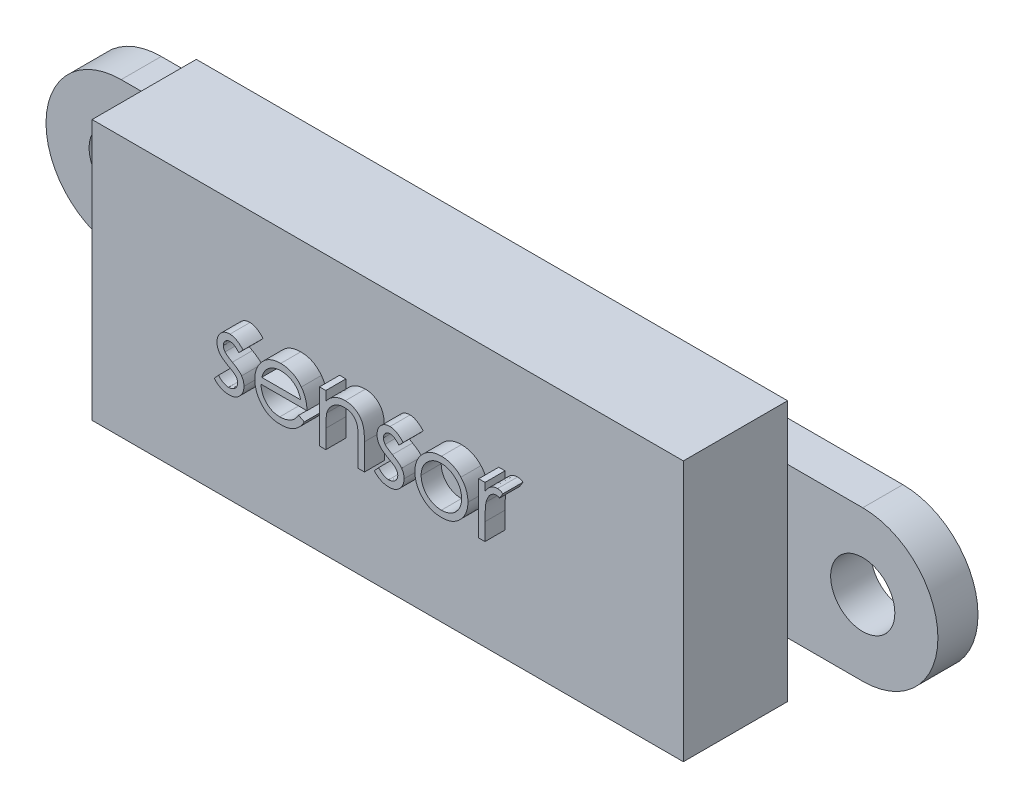
from build123d import *

# Parameters (mm, degrees)
SKETCH_1_R      = 1.6
EXTRUDE_1_DEPTH = 2
SKETCH_2_W      = 29.5
SKETCH_2_H      = 13
EXTRUDE_2_DEPTH = 5.2
EXTRUDE_3_DEPTH = 1


with BuildPart() as part:
    # ｽｹｯﾁ1 → ﾎﾞｽ - 押し出し1 (new body)
    with BuildSketch(Plane.XY):
        with BuildLine():
            Line((-18.5, 3.75), (18.5, 3.75))
            ThreePointArc((18.5, 3.75), (22.25, 0), (18.5, -3.75))
            Line((18.5, -3.75), (-18.5, -3.75))
            ThreePointArc((-18.5, -3.75), (-22.25, 0), (-18.5, 3.75))
        make_face()
        with Locations((-18.5, 0)):
            Circle(SKETCH_1_R, mode=Mode.SUBTRACT)
        with Locations((18.5, 0)):
            Circle(SKETCH_1_R, mode=Mode.SUBTRACT)
    extrude(amount=EXTRUDE_1_DEPTH)

    # ｽｹｯﾁ2 → ﾎﾞｽ - 押し出し2 (add)
    with BuildSketch(Plane.XY.offset(2)):
        Rectangle(SKETCH_2_W, SKETCH_2_H)
    extrude(amount=EXTRUDE_2_DEPTH)

    # ｽｹｯﾁ3 → ﾎﾞｽ - 押し出し3 (add)
    # profile 1 of 6: a face of its own
    with BuildSketch(Plane.XY.offset(7.2)):
        with BuildLine():
            Line((-6.217257934, 1.304073049), (-6.430398959, 1.084621927))
            add(Edge.make_bspline(
                [(-6.430398959, 1.084621927), (-6.448789463, 1.105935073), (-6.484244189, 1.14702431), (-6.54047567, 1.201961377), (-6.596499273, 1.248098316), (-6.651548087, 1.287050575), (-6.707006356, 1.316499721), (-6.762223274, 1.337994583), (-6.817256013, 1.351296389), (-6.854042048, 1.353010828), (-6.87210569, 1.353852696)],
                knots=[0, 0, 0, 0, 1.26578478, 2.440284043, 3.530471711, 4.527705817, 5.468200915, 6.346673037, 7.188140097, 8, 8, 8, 8], degree=3))
            add(Edge.make_bspline(
                [(-6.87210569, 1.353852696), (-6.89424508, 1.352777823), (-6.937812266, 1.350662625), (-7.000238084, 1.329549195), (-7.058188709, 1.297140457), (-7.108345689, 1.251171873), (-7.150833369, 1.198407604), (-7.18184705, 1.139411279), (-7.200813034, 1.075963236), (-7.203217766, 1.031933378), (-7.204437421, 1.009601895)],
                knots=[0, 0, 0, 0, 0.99966794, 1.967205029, 2.953328237, 3.988086729, 5.028030931, 6.008226631, 6.989793394, 8, 8, 8, 8], degree=3))
            add(Edge.make_bspline(
                [(-7.204437421, 1.009601895), (-7.203326609, 0.989389851), (-7.201108115, 0.94902274), (-7.183861436, 0.889474706), (-7.156395364, 0.831417668), (-7.13072517, 0.795854762), (-7.117498318, 0.777530581)],
                knots=[0, 0, 0, 0, 0.960159726, 1.917612774, 2.927026955, 4, 4, 4, 4], degree=3))
            add(Edge.make_bspline(
                [(-7.117498318, 0.777530581), (-7.109534825, 0.767745996), (-7.092585532, 0.746920742), (-7.060777017, 0.718016889), (-7.024754514, 0.686074638), (-6.981434576, 0.654137801), (-6.932683548, 0.620506075), (-6.877444264, 0.586503942), (-6.817469759, 0.549539517), (-6.774532453, 0.526095082), (-6.752213863, 0.513908786)],
                knots=[0, 0, 0, 0, 0.66740084, 1.420478572, 2.27185888, 3.217733974, 4.268547843, 5.408967954, 6.65319498, 8, 8, 8, 8], degree=3))
            add(Edge.make_bspline(
                [(-6.752213863, 0.513908786), (-6.725000286, 0.498663883), (-6.672432616, 0.469215751), (-6.597739849, 0.423506047), (-6.529952808, 0.378074623), (-6.46849714, 0.333407349), (-6.414555331, 0.288254481), (-6.366490779, 0.244346724), (-6.325502335, 0.200357416), (-6.302548408, 0.169624303), (-6.291576844, 0.154934427)],
                knots=[0, 0, 0, 0, 1.27191281, 2.456916733, 3.569705269, 4.599008579, 5.553216877, 6.436649441, 7.252746552, 8, 8, 8, 8], degree=3))
            add(Edge.make_bspline(
                [(-6.291576844, 0.154934427), (-6.273366317, 0.125268339), (-6.237123987, 0.066227318), (-6.199065721, -0.03099111), (-6.177005446, -0.134101612), (-6.173943226, -0.204633832), (-6.172386139, -0.240498265)],
                knots=[0, 0, 0, 0, 0.995354457, 1.980940102, 2.973342416, 4, 4, 4, 4], degree=3))
            add(Edge.make_bspline(
                [(-6.172386139, -0.240498265), (-6.173105673, -0.265767412), (-6.174523593, -0.315563025), (-6.18438166, -0.388897854), (-6.201336636, -0.459032412), (-6.22443039, -0.526727697), (-6.255614763, -0.590686636), (-6.29216256, -0.652522885), (-6.336037472, -0.710898816), (-6.386128847, -0.765737776), (-6.440974341, -0.815823524), (-6.49948048, -0.859847478), (-6.56171931, -0.896421815), (-6.627246112, -0.92668716), (-6.696209766, -0.950755418), (-6.768621055, -0.967417949), (-6.84424981, -0.97739071), (-6.895679618, -0.978775186), (-6.921885338, -0.979480637)],
                knots=[0, 0, 0, 0, 1.032770009, 2.035186124, 3.017557409, 3.978232242, 4.952395191, 5.920591857, 6.910227898, 7.931268572, 8.952309245, 9.941945286, 10.918353717, 11.897095711, 12.887975737, 13.898235213, 14.929059601, 16, 16, 16, 16], degree=3))
            add(Edge.make_bspline(
                [(-6.921885338, -0.979480637), (-6.957252513, -0.978487937), (-7.02749544, -0.97651633), (-7.131385159, -0.958010268), (-7.232905918, -0.929214875), (-7.331289458, -0.88949894), (-7.424335572, -0.839348228), (-7.509466497, -0.779285834), (-7.586977959, -0.711295837), (-7.631096233, -0.659182926), (-7.65315537, -0.63312647)],
                knots=[0, 0, 0, 0, 1.013940152, 2.01379169, 3.017749504, 4.037548394, 5.051665909, 6.043208538, 7.021604269, 8, 8, 8, 8], degree=3))
            Line((-7.65315537, -0.63312647), (-7.444922197, -0.396147304))
            add(Edge.make_bspline(
                [(-7.444922197, -0.396147304), (-7.425149784, -0.417502068), (-7.386817971, -0.458901508), (-7.325516755, -0.514025849), (-7.263137353, -0.56022712), (-7.200302667, -0.598870535), (-7.136082573, -0.628645938), (-7.070836958, -0.649564532), (-7.004698534, -0.663008724), (-6.960276398, -0.664587006), (-6.938011139, -0.665378073)],
                knots=[0, 0, 0, 0, 1.179806542, 2.287233372, 3.337373186, 4.324005949, 5.273901747, 6.200048787, 7.097828587, 8, 8, 8, 8], degree=3))
            add(Edge.make_bspline(
                [(-6.938011139, -0.665378073), (-6.907693213, -0.664007248), (-6.848457071, -0.661328886), (-6.763613313, -0.637011794), (-6.685274686, -0.598881843), (-6.617251341, -0.544797144), (-6.55934918, -0.481841572), (-6.517421005, -0.410927452), (-6.49114483, -0.334135996), (-6.488058831, -0.280903693), (-6.486488703, -0.253819579)],
                knots=[0, 0, 0, 0, 1.072336372, 2.095165389, 3.102688358, 4.141489647, 5.156069229, 6.117746104, 7.042326257, 8, 8, 8, 8], degree=3))
            add(Edge.make_bspline(
                [(-6.486488703, -0.253819579), (-6.487574997, -0.231509961), (-6.48971974, -0.187462605), (-6.506563012, -0.123712264), (-6.533175864, -0.063242983), (-6.559380513, -0.027853336), (-6.572726684, -0.009829195)],
                knots=[0, 0, 0, 0, 1.013901739, 2.00181326, 2.98231254, 4, 4, 4, 4], degree=3))
            add(Edge.make_bspline(
                [(-6.572726684, -0.009829195), (-6.580749078, -0.000793833), (-6.598224751, 0.018888449), (-6.630279992, 0.047313528), (-6.668661854, 0.077951627), (-6.713802017, 0.110283216), (-6.765791479, 0.143881822), (-6.824840954, 0.178571174), (-6.890141507, 0.2159989), (-6.936312138, 0.240818555), (-6.960447036, 0.2537926)],
                knots=[0, 0, 0, 0, 0.615000592, 1.339693406, 2.178160186, 3.116406724, 4.166410947, 5.330106347, 6.604359322, 8, 8, 8, 8], degree=3))
            add(Edge.make_bspline(
                [(-6.960447036, 0.2537926), (-6.986493676, 0.268331732), (-7.037006424, 0.296527748), (-7.108553715, 0.340443828), (-7.173101069, 0.385111103), (-7.232201644, 0.428023942), (-7.284362649, 0.471444886), (-7.329378598, 0.515422138), (-7.369021813, 0.558182124), (-7.390969225, 0.58847942), (-7.401452645, 0.602951254)],
                knots=[0, 0, 0, 0, 1.262093308, 2.447601706, 3.550203992, 4.582594899, 5.537233252, 6.418365656, 7.244515135, 8, 8, 8, 8], degree=3))
            add(Edge.make_bspline(
                [(-7.401452645, 0.602951254), (-7.419583245, 0.632096869), (-7.45585078, 0.690398284), (-7.491065971, 0.787708761), (-7.515272, 0.890153818), (-7.51743439, 0.960840673), (-7.518539985, 0.996981703)],
                knots=[0, 0, 0, 0, 0.985009483, 1.970363186, 2.962279964, 4, 4, 4, 4], degree=3))
            add(Edge.make_bspline(
                [(-7.518539985, 0.996981703), (-7.51800579, 1.020607101), (-7.516960294, 1.066845352), (-7.508616242, 1.134784172), (-7.493424531, 1.199332326), (-7.474369608, 1.261459189), (-7.447886604, 1.319961283), (-7.416240699, 1.375618754), (-7.379053274, 1.428354672), (-7.336209983, 1.477357804), (-7.289103338, 1.52186713), (-7.238208568, 1.560665758), (-7.184670311, 1.593772113), (-7.128261892, 1.621537274), (-7.068441419, 1.642538656), (-7.005627033, 1.656996041), (-6.939945878, 1.666651244), (-6.895044752, 1.667514328), (-6.87210569, 1.66795526)],
                knots=[0, 0, 0, 0, 1.087655834, 2.128696564, 3.144119009, 4.137814668, 5.115653402, 6.093965665, 7.082169637, 8.081268856, 9.086088321, 10.061021666, 11.022561449, 11.980240094, 12.950172527, 13.934149372, 14.944599409, 16, 16, 16, 16], degree=3))
            add(Edge.make_bspline(
                [(-6.87210569, 1.66795526), (-6.844913627, 1.66685092), (-6.790019405, 1.664621522), (-6.707664779, 1.646915831), (-6.625431437, 1.617782727), (-6.543108087, 1.577546494), (-6.461297797, 1.525479618), (-6.379280941, 1.462550319), (-6.29607291, 1.389172604), (-6.244116597, 1.333073379), (-6.217257934, 1.304073049)],
                knots=[0, 0, 0, 0, 0.845714091, 1.707292901, 2.609013841, 3.555613372, 4.552488639, 5.621697636, 6.770543573, 8, 8, 8, 8], degree=3))
        make_face()
    # profile 2 of 6: a face of its own
    with BuildSketch(Plane.XY.offset(7.2)):
        with BuildLine():
            Line((-3.445022357, -0.126916535), (-3.165975882, -0.27345099))
            add(Edge.make_bspline(
                [(-3.165975882, -0.27345099), (-3.188212478, -0.312894321), (-3.231476086, -0.389635424), (-3.305876834, -0.495067284), (-3.383868907, -0.589915), (-3.468972875, -0.671644654), (-3.558642554, -0.742896039), (-3.653375208, -0.805233864), (-3.753664026, -0.858352384), (-3.859513751, -0.903104912), (-3.971813302, -0.937514406), (-4.090834818, -0.961818627), (-4.216806314, -0.976841896), (-4.303152494, -0.978587037), (-4.347366107, -0.979480637)],
                knots=[0, 0, 0, 0, 1.120438281, 2.179929193, 3.190490725, 4.156257408, 5.095198341, 6.022838206, 6.959905092, 7.901321166, 8.864066838, 9.862729781, 10.905609505, 12, 12, 12, 12], degree=3))
            add(Edge.make_bspline(
                [(-4.347366107, -0.979480637), (-4.396508084, -0.978333462), (-4.492369846, -0.976095655), (-4.631909593, -0.956803191), (-4.763289012, -0.925330832), (-4.886500715, -0.88136529), (-5.001242967, -0.823937966), (-5.107743822, -0.753978485), (-5.206563348, -0.67184623), (-5.294587557, -0.576829786), (-5.37383144, -0.475147829), (-5.44375726, -0.369191945), (-5.502214691, -0.25922872), (-5.549767301, -0.145958196), (-5.588172166, -0.030094303), (-5.61493887, 0.089417165), (-5.630368618, 0.212252749), (-5.632733063, 0.295350085), (-5.6339246, 0.337226094)],
                knots=[0, 0, 0, 0, 1.145258523, 2.234067595, 3.276747158, 4.290159414, 5.277019952, 6.260822364, 7.254936242, 8.264827045, 9.274100331, 10.257902744, 11.220704747, 12.172965371, 13.118907548, 14.062713208, 15.023725156, 16, 16, 16, 16], degree=3))
            add(Edge.make_bspline(
                [(-5.6339246, 0.337226094), (-5.632865459, 0.376520924), (-5.630766381, 0.454398089), (-5.617535593, 0.569663633), (-5.5940873, 0.681692086), (-5.561910976, 0.790576534), (-5.52035973, 0.896134668), (-5.469527511, 0.998430731), (-5.409335133, 1.097355871), (-5.362862459, 1.159759005), (-5.339453447, 1.19119244)],
                knots=[0, 0, 0, 0, 1.024358464, 2.0301432, 3.019427413, 4.004406732, 4.986367066, 5.972626655, 6.978780325, 8, 8, 8, 8], degree=3))
            add(Edge.make_bspline(
                [(-5.339453447, 1.19119244), (-5.307745764, 1.22906131), (-5.245334817, 1.30359946), (-5.139778462, 1.401537786), (-5.025478265, 1.483581561), (-4.903866639, 1.551588697), (-4.773530165, 1.603262344), (-4.636220874, 1.641769927), (-4.490375288, 1.663347938), (-4.390670067, 1.666395771), (-4.339653767, 1.66795526)],
                knots=[0, 0, 0, 0, 1.030682036, 2.02871468, 2.997146059, 3.962720338, 4.930598197, 5.918074684, 6.934738563, 8, 8, 8, 8], degree=3))
            add(Edge.make_bspline(
                [(-4.339653767, 1.66795526), (-4.287206162, 1.666601211), (-4.184315916, 1.663944876), (-4.034283795, 1.639318543), (-3.892323078, 1.600265988), (-3.758490574, 1.545112198), (-3.632772713, 1.473952646), (-3.515986664, 1.385810804), (-3.406135151, 1.283392717), (-3.342226572, 1.204629508), (-3.30970585, 1.164549812)],
                knots=[0, 0, 0, 0, 1.056321875, 2.072262726, 3.055038591, 4.01806755, 4.982017516, 5.957941055, 6.960871419, 8, 8, 8, 8], degree=3))
            add(Edge.make_bspline(
                [(-3.30970585, 1.164549812), (-3.287578912, 1.13434623), (-3.243472319, 1.074140111), (-3.188225219, 0.975968954), (-3.140267824, 0.87325836), (-3.101934863, 0.764348063), (-3.070895362, 0.650528483), (-3.048438543, 0.530985938), (-3.035268924, 0.405756027), (-3.032680227, 0.320429471), (-3.031360498, 0.276929619)],
                knots=[0, 0, 0, 0, 0.94817472, 1.890038105, 2.849395472, 3.817997239, 4.812318967, 5.836947057, 6.897266129, 8, 8, 8, 8], degree=3))
            Line((-3.031360498, 0.276929619), (-5.319822036, 0.276929619))
            add(Edge.make_bspline(
                [(-5.319822036, 0.276929619), (-5.31828243, 0.243229155), (-5.315254856, 0.176958551), (-5.301139713, 0.079987768), (-5.278890939, -0.012385574), (-5.247621876, -0.099468616), (-5.209755031, -0.182398743), (-5.163369314, -0.26056078), (-5.10802976, -0.33359871), (-5.046304061, -0.402165848), (-4.977596966, -0.463226609), (-4.905314218, -0.517878385), (-4.828420653, -0.563683982), (-4.74752257, -0.600863872), (-4.662750785, -0.629970188), (-4.57407859, -0.649838009), (-4.481680473, -0.663145116), (-4.418694739, -0.664624781), (-4.386628927, -0.665378073)],
                knots=[0, 0, 0, 0, 1.094153842, 2.151609401, 3.174256925, 4.172055639, 5.149267565, 6.128595816, 7.11444997, 8.118368179, 9.117203808, 10.09244225, 11.054858984, 12.015122123, 12.976791628, 13.957293641, 14.960065497, 16, 16, 16, 16], degree=3))
            add(Edge.make_bspline(
                [(-4.386628927, -0.665378073), (-4.35527778, -0.664770016), (-4.293071089, -0.663563515), (-4.200430231, -0.651831604), (-4.109290704, -0.632861329), (-4.020029721, -0.606971339), (-3.934458875, -0.575394487), (-3.855213325, -0.537291629), (-3.782333109, -0.495141882), (-3.714216143, -0.446932207), (-3.648145149, -0.38792402), (-3.582602663, -0.314288299), (-3.512326009, -0.227200771), (-3.468336417, -0.161655105), (-3.445022357, -0.126916535)],
                knots=[0, 0, 0, 0, 0.99110716, 1.966546729, 2.947904876, 3.932708344, 4.903319531, 5.828989031, 6.710028674, 7.56322171, 8.463672341, 9.504779593, 10.677557249, 12, 12, 12, 12], degree=3))
        make_face()
        with BuildLine():
            add(Edge.make_bspline(
                [(-3.345463062, 0.591032183), (-3.356959686, 0.632695057), (-3.379086988, 0.712882678), (-3.425323352, 0.823923568), (-3.477394893, 0.922611469), (-3.539016624, 1.008191102), (-3.60883535, 1.084194615), (-3.689480533, 1.1506132), (-3.779916426, 1.210030651), (-3.879675567, 1.260183151), (-3.985317352, 1.30287301), (-4.095923544, 1.331498125), (-4.208781332, 1.351107668), (-4.285115618, 1.352933776), (-4.323527966, 1.353852696)],
                knots=[0, 0, 0, 0, 1.154881502, 2.222775134, 3.210006277, 4.132804581, 5.035138423, 5.962687519, 6.919655026, 7.923214229, 8.944639381, 9.960483929, 10.97369054, 12, 12, 12, 12], degree=3))
            add(Edge.make_bspline(
                [(-4.323527966, 1.353852696), (-4.354877404, 1.353241025), (-4.416848653, 1.352031879), (-4.508149722, 1.340561749), (-4.59582942, 1.321601904), (-4.680534708, 1.295636948), (-4.761155576, 1.261028345), (-4.839350345, 1.220445119), (-4.913130741, 1.170903535), (-4.959272036, 1.13314468), (-4.982582453, 1.114069042)],
                knots=[0, 0, 0, 0, 1.04873581, 2.073130211, 3.073294108, 4.04793562, 5.032784715, 6.005352987, 6.992311501, 8, 8, 8, 8], degree=3))
            add(Edge.make_bspline(
                [(-4.982582453, 1.114069042), (-4.999275735, 1.098974727), (-5.033058869, 1.068427511), (-5.078199391, 1.015798304), (-5.121419863, 0.959046742), (-5.160753516, 0.896001617), (-5.196831103, 0.827380838), (-5.23059108, 0.753763203), (-5.260977492, 0.674590073), (-5.278073602, 0.619417634), (-5.286869312, 0.591032183)],
                knots=[0, 0, 0, 0, 0.879870761, 1.780643979, 2.707998968, 3.669668524, 4.684282772, 5.740141944, 6.837334558, 8, 8, 8, 8], degree=3))
            Line((-5.286869312, 0.591032183), (-3.345463062, 0.591032183))
        make_face(mode=Mode.SUBTRACT)
    # profile 3 of 6: a face of its own
    with BuildSketch(Plane.XY.offset(7.2)):
        with BuildLine():
            Line((-2.40315537, 1.623083465), (-2.089052806, 1.623083465))
            Line((-2.089052806, 1.623083465), (-2.089052806, 1.161745324))
            add(Edge.make_bspline(
                [(-2.089052806, 1.161745324), (-2.05551517, 1.203588047), (-1.990434219, 1.284785311), (-1.882049886, 1.391505885), (-1.767505986, 1.47945111), (-1.647503982, 1.549554904), (-1.521880972, 1.60240153), (-1.391402702, 1.640567462), (-1.255287996, 1.66345229), (-1.162723559, 1.66644252), (-1.115895754, 1.66795526)],
                knots=[0, 0, 0, 0, 1.12780773, 2.188550248, 3.19190651, 4.159438251, 5.104880172, 6.052711206, 7.014878035, 8, 8, 8, 8], degree=3))
            add(Edge.make_bspline(
                [(-1.115895754, 1.66795526), (-1.06856512, 1.666210065), (-0.975927652, 1.662794296), (-0.841049591, 1.635777605), (-0.715076197, 1.58963235), (-0.598456642, 1.52642028), (-0.493329428, 1.447813806), (-0.401004577, 1.356236025), (-0.324641329, 1.250899941), (-0.273443966, 1.153176785), (-0.239718319, 1.066487991), (-0.218485981, 0.992241241), (-0.200455, 0.90952309), (-0.184823252, 0.818583501), (-0.17424614, 0.71878531), (-0.165903848, 0.610537618), (-0.159925154, 0.493875488), (-0.159687947, 0.41318886), (-0.159565626, 0.371581062)],
                knots=[0, 0, 0, 0, 1.235846778, 2.418850247, 3.575807741, 4.728682307, 5.871620074, 6.994088408, 8.11269785, 9.256955736, 9.865816715, 10.540099792, 11.271859618, 12.076849838, 12.949306005, 13.892391288, 14.913166135, 16, 16, 16, 16], degree=3))
            Line((-0.159565626, 0.371581062), (-0.159565626, -0.934608842))
            Line((-0.159565626, -0.934608842), (-0.47366819, -0.934608842))
            Line((-0.47366819, -0.934608842), (-0.47366819, 0.268516158))
            add(Edge.make_bspline(
                [(-0.47366819, 0.268516158), (-0.473861398, 0.303338603), (-0.474230972, 0.369948013), (-0.475396619, 0.465317037), (-0.478206426, 0.551803615), (-0.482154738, 0.629200982), (-0.487933769, 0.697434819), (-0.4939564, 0.756644096), (-0.501321377, 0.806753638), (-0.50788429, 0.836918721), (-0.510827645, 0.850447247)],
                knots=[0, 0, 0, 0, 1.430800155, 2.736877192, 3.918605307, 4.986035426, 5.920637409, 6.731861385, 7.431261377, 8, 8, 8, 8], degree=3))
            add(Edge.make_bspline(
                [(-0.510827645, 0.850447247), (-0.521453177, 0.890158432), (-0.541904037, 0.966590177), (-0.592438021, 1.07026453), (-0.656252201, 1.158462717), (-0.734150051, 1.230639439), (-0.825379126, 1.286810276), (-0.929686269, 1.325784231), (-1.04606491, 1.3501605), (-1.127919292, 1.352587632), (-1.170583254, 1.353852696)],
                knots=[0, 0, 0, 0, 1.084156227, 2.086665306, 3.027808233, 3.945421172, 4.874247719, 5.839848303, 6.874090471, 8, 8, 8, 8], degree=3))
            add(Edge.make_bspline(
                [(-1.170583254, 1.353852696), (-1.195850938, 1.353376692), (-1.245855031, 1.352434691), (-1.320005003, 1.342983393), (-1.391929176, 1.327524937), (-1.462349385, 1.306656299), (-1.529857179, 1.27799403), (-1.59662147, 1.24546466), (-1.660128234, 1.204916448), (-1.721731631, 1.159725827), (-1.779044439, 1.109646619), (-1.832372777, 1.056802109), (-1.879910797, 1.000526505), (-1.922979473, 0.941726558), (-1.960157736, 0.87959472), (-1.992610824, 0.814730413), (-2.020146519, 0.747048265), (-2.033829211, 0.700073203), (-2.040675402, 0.676569042)],
                knots=[0, 0, 0, 0, 1.023777757, 2.026029729, 3.023749952, 4.003683103, 4.997618607, 5.993177895, 7.010360494, 8.046726602, 9.087585522, 10.09234134, 11.086953743, 12.070360549, 13.043493632, 14.017870808, 15.008233677, 16, 16, 16, 16], degree=3))
            add(Edge.make_bspline(
                [(-2.040675402, 0.676569042), (-2.04461505, 0.659313839), (-2.053191459, 0.621750165), (-2.062454639, 0.560105745), (-2.070862214, 0.488795771), (-2.077899173, 0.407903453), (-2.082204589, 0.317145578), (-2.086898986, 0.216909741), (-2.088608047, 0.106796252), (-2.088900401, 0.030134559), (-2.089052806, -0.009829195)],
                knots=[0, 0, 0, 0, 0.615963638, 1.340920617, 2.168419149, 3.115676021, 4.16674242, 5.331190069, 6.6087489, 8, 8, 8, 8], degree=3))
            Line((-2.089052806, -0.009829195), (-2.089052806, -0.934608842))
            Line((-2.089052806, -0.934608842), (-2.40315537, -0.934608842))
            Line((-2.40315537, -0.934608842), (-2.40315537, 1.623083465))
        make_face()
    # profile 4 of 6: a face of its own
    with BuildSketch(Plane.XY.offset(7.2)):
        with BuildLine():
            Line((1.769921553, 1.304073049), (1.556780528, 1.084621927))
            add(Edge.make_bspline(
                [(1.556780528, 1.084621927), (1.538390024, 1.105935073), (1.502935298, 1.14702431), (1.446703817, 1.201961377), (1.390680214, 1.248098316), (1.3356314, 1.287050575), (1.280173131, 1.316499721), (1.224956213, 1.337994583), (1.169923475, 1.351296389), (1.133137439, 1.353010828), (1.115073797, 1.353852696)],
                knots=[0, 0, 0, 0, 1.26578478, 2.440284043, 3.530471711, 4.527705817, 5.468200915, 6.346673037, 7.188140097, 8, 8, 8, 8], degree=3))
            add(Edge.make_bspline(
                [(1.115073797, 1.353852696), (1.092934407, 1.352777823), (1.049367221, 1.350662625), (0.986941403, 1.329549195), (0.928990778, 1.297140457), (0.878833798, 1.251171873), (0.836346118, 1.198407604), (0.805332437, 1.139411279), (0.786366453, 1.075963236), (0.783961721, 1.031933378), (0.782742066, 1.009601895)],
                knots=[0, 0, 0, 0, 0.99966794, 1.967205029, 2.953328237, 3.988086729, 5.028030931, 6.008226631, 6.989793394, 8, 8, 8, 8], degree=3))
            add(Edge.make_bspline(
                [(0.782742066, 1.009601895), (0.783852879, 0.989389851), (0.786071372, 0.94902274), (0.803318051, 0.889474706), (0.830784123, 0.831417668), (0.856454317, 0.795854762), (0.869681169, 0.777530581)],
                knots=[0, 0, 0, 0, 0.960159726, 1.917612774, 2.927026955, 4, 4, 4, 4], degree=3))
            add(Edge.make_bspline(
                [(0.869681169, 0.777530581), (0.877644663, 0.767745996), (0.894593955, 0.746920742), (0.92640247, 0.718016889), (0.962424973, 0.686074638), (1.005744911, 0.654137801), (1.054495939, 0.620506075), (1.109735223, 0.586503942), (1.169709728, 0.549539517), (1.212647035, 0.526095082), (1.234965624, 0.513908786)],
                knots=[0, 0, 0, 0, 0.66740084, 1.420478572, 2.27185888, 3.217733974, 4.268547843, 5.408967954, 6.65319498, 8, 8, 8, 8], degree=3))
            add(Edge.make_bspline(
                [(1.234965624, 0.513908786), (1.262179201, 0.498663883), (1.314746871, 0.469215751), (1.389439638, 0.423506047), (1.457226679, 0.378074623), (1.518682347, 0.333407349), (1.572624156, 0.288254481), (1.620688708, 0.244346724), (1.661677152, 0.200357416), (1.684631079, 0.169624303), (1.695602643, 0.154934427)],
                knots=[0, 0, 0, 0, 1.27191281, 2.456916733, 3.569705269, 4.599008579, 5.553216877, 6.436649441, 7.252746552, 8, 8, 8, 8], degree=3))
            add(Edge.make_bspline(
                [(1.695602643, 0.154934427), (1.713813171, 0.125268339), (1.7500555, 0.066227318), (1.788113766, -0.03099111), (1.810174041, -0.134101612), (1.813236261, -0.204633832), (1.814793348, -0.240498265)],
                knots=[0, 0, 0, 0, 0.995354457, 1.980940102, 2.973342416, 4, 4, 4, 4], degree=3))
            add(Edge.make_bspline(
                [(1.814793348, -0.240498265), (1.814073815, -0.265767412), (1.812655895, -0.315563025), (1.802797828, -0.388897854), (1.785842851, -0.459032412), (1.762749097, -0.526727697), (1.731564724, -0.590686636), (1.695016927, -0.652522885), (1.651142016, -0.710898816), (1.60105064, -0.765737776), (1.546205146, -0.815823524), (1.487699008, -0.859847478), (1.425460177, -0.896421815), (1.359933376, -0.92668716), (1.290969721, -0.950755418), (1.218558432, -0.967417949), (1.142929678, -0.97739071), (1.091499869, -0.978775186), (1.06529415, -0.979480637)],
                knots=[0, 0, 0, 0, 1.032770009, 2.035186124, 3.017557409, 3.978232242, 4.952395191, 5.920591857, 6.910227898, 7.931268572, 8.952309245, 9.941945286, 10.918353717, 11.897095711, 12.887975737, 13.898235213, 14.929059601, 16, 16, 16, 16], degree=3))
            add(Edge.make_bspline(
                [(1.06529415, -0.979480637), (1.029926974, -0.978487937), (0.959684047, -0.97651633), (0.855794328, -0.958010268), (0.754273569, -0.929214875), (0.655890029, -0.88949894), (0.562843915, -0.839348228), (0.477712991, -0.779285834), (0.400201528, -0.711295837), (0.356083254, -0.659182926), (0.334024118, -0.63312647)],
                knots=[0, 0, 0, 0, 1.013940152, 2.01379169, 3.017749504, 4.037548394, 5.051665909, 6.043208538, 7.021604269, 8, 8, 8, 8], degree=3))
            Line((0.334024118, -0.63312647), (0.542257291, -0.396147304))
            add(Edge.make_bspline(
                [(0.542257291, -0.396147304), (0.562029704, -0.417502068), (0.600361516, -0.458901508), (0.661662733, -0.514025849), (0.724042134, -0.56022712), (0.78687682, -0.598870535), (0.851096915, -0.628645938), (0.916342529, -0.649564532), (0.982480953, -0.663008724), (1.026903089, -0.664587006), (1.049168348, -0.665378073)],
                knots=[0, 0, 0, 0, 1.179806542, 2.287233372, 3.337373186, 4.324005949, 5.273901747, 6.200048787, 7.097828587, 8, 8, 8, 8], degree=3))
            add(Edge.make_bspline(
                [(1.049168348, -0.665378073), (1.079486274, -0.664007248), (1.138722416, -0.661328886), (1.223566174, -0.637011794), (1.301904801, -0.598881843), (1.369928146, -0.544797144), (1.427830308, -0.481841572), (1.469758482, -0.410927452), (1.496034657, -0.334135996), (1.499120656, -0.280903693), (1.500690784, -0.253819579)],
                knots=[0, 0, 0, 0, 1.072336372, 2.095165389, 3.102688358, 4.141489647, 5.156069229, 6.117746104, 7.042326257, 8, 8, 8, 8], degree=3))
            add(Edge.make_bspline(
                [(1.500690784, -0.253819579), (1.49960449, -0.231509961), (1.497459747, -0.187462605), (1.480616475, -0.123712264), (1.454003623, -0.063242983), (1.427798975, -0.027853336), (1.414452803, -0.009829195)],
                knots=[0, 0, 0, 0, 1.013901739, 2.00181326, 2.98231254, 4, 4, 4, 4], degree=3))
            add(Edge.make_bspline(
                [(1.414452803, -0.009829195), (1.406430409, -0.000793833), (1.388954737, 0.018888449), (1.356899495, 0.047313528), (1.318517633, 0.077951627), (1.27337747, 0.110283216), (1.221388008, 0.143881822), (1.162338533, 0.178571174), (1.09703798, 0.2159989), (1.050867349, 0.240818555), (1.026732451, 0.2537926)],
                knots=[0, 0, 0, 0, 0.615000592, 1.339693406, 2.178160186, 3.116406724, 4.166410947, 5.330106347, 6.604359322, 8, 8, 8, 8], degree=3))
            add(Edge.make_bspline(
                [(1.026732451, 0.2537926), (1.000685811, 0.268331732), (0.950173063, 0.296527748), (0.878625772, 0.340443828), (0.814078418, 0.385111103), (0.754977844, 0.428023942), (0.702816838, 0.471444886), (0.65780089, 0.515422138), (0.618157674, 0.558182124), (0.596210262, 0.58847942), (0.585726842, 0.602951254)],
                knots=[0, 0, 0, 0, 1.262093308, 2.447601706, 3.550203992, 4.582594899, 5.537233252, 6.418365656, 7.244515135, 8, 8, 8, 8], degree=3))
            add(Edge.make_bspline(
                [(0.585726842, 0.602951254), (0.567596242, 0.632096869), (0.531328707, 0.690398284), (0.496113516, 0.787708761), (0.471907487, 0.890153818), (0.469745097, 0.960840673), (0.468639502, 0.996981703)],
                knots=[0, 0, 0, 0, 0.985009483, 1.970363186, 2.962279964, 4, 4, 4, 4], degree=3))
            add(Edge.make_bspline(
                [(0.468639502, 0.996981703), (0.469173697, 1.020607101), (0.470219193, 1.066845352), (0.478563245, 1.134784172), (0.493754956, 1.199332326), (0.512809879, 1.261459189), (0.539292883, 1.319961283), (0.570938788, 1.375618754), (0.608126213, 1.428354672), (0.650969504, 1.477357804), (0.698076149, 1.52186713), (0.748970919, 1.560665758), (0.802509176, 1.593772113), (0.858917595, 1.621537274), (0.918738068, 1.642538656), (0.981552455, 1.656996041), (1.047233609, 1.666651244), (1.092134735, 1.667514328), (1.115073797, 1.66795526)],
                knots=[0, 0, 0, 0, 1.087655834, 2.128696564, 3.144119009, 4.137814668, 5.115653402, 6.093965665, 7.082169637, 8.081268856, 9.086088321, 10.061021666, 11.022561449, 11.980240094, 12.950172527, 13.934149372, 14.944599409, 16, 16, 16, 16], degree=3))
            add(Edge.make_bspline(
                [(1.115073797, 1.66795526), (1.142265861, 1.66685092), (1.197160082, 1.664621522), (1.279514708, 1.646915831), (1.36174805, 1.617782727), (1.4440714, 1.577546494), (1.52588169, 1.525479618), (1.607898546, 1.462550319), (1.691106577, 1.389172604), (1.74306289, 1.333073379), (1.769921553, 1.304073049)],
                knots=[0, 0, 0, 0, 0.845714091, 1.707292901, 2.609013841, 3.555613372, 4.552488639, 5.621697636, 6.770543573, 8, 8, 8, 8], degree=3))
        make_face()
    # profile 5 of 6: a face of its own
    with BuildSketch(Plane.XY.offset(7.2)):
        with BuildLine():
            add(Edge.make_bspline(
                [(3.678375079, 1.66795526), (3.726366352, 1.666933369), (3.82046551, 1.66492969), (3.958273395, 1.643514725), (4.089818531, 1.61076736), (4.215604723, 1.565495798), (4.334021019, 1.504813848), (4.446792263, 1.432404557), (4.553609272, 1.346621963), (4.617632301, 1.280263895), (4.650129887, 1.246581062)],
                knots=[0, 0, 0, 0, 1.054011418, 2.066658804, 3.057071809, 4.030435133, 4.997543892, 5.974964718, 6.972108034, 8, 8, 8, 8], degree=3))
            add(Edge.make_bspline(
                [(4.650129887, 1.246581062), (4.678111841, 1.214367076), (4.733534221, 1.150562534), (4.80459994, 1.047106921), (4.8658215, 0.93996682), (4.914884461, 0.827719493), (4.953569485, 0.711344822), (4.981035181, 0.590442811), (4.997372116, 0.465280464), (4.999575083, 0.380276626), (5.000690784, 0.337226094)],
                knots=[0, 0, 0, 0, 1.025258237, 2.030674902, 3.01204498, 3.988269485, 4.97094183, 5.956517959, 6.965070386, 8, 8, 8, 8], degree=3))
            add(Edge.make_bspline(
                [(5.000690784, 0.337226094), (4.999709447, 0.293926036), (4.997770279, 0.208363103), (4.979426662, 0.082343737), (4.950895576, -0.039851086), (4.910063738, -0.15770978), (4.857705629, -0.271592607), (4.793814941, -0.381002156), (4.717943324, -0.48615429), (4.631939327, -0.586156128), (4.536887451, -0.678322343), (4.433771303, -0.758650612), (4.324617269, -0.827472137), (4.207973916, -0.882908552), (4.084906429, -0.926618252), (3.955149361, -0.957318269), (3.818904291, -0.975879953), (3.725877069, -0.978263526), (3.678375079, -0.979480637)],
                knots=[0, 0, 0, 0, 0.998656419, 1.973391657, 2.932242238, 3.890759089, 4.846373663, 5.82037756, 6.809684879, 7.83454468, 8.860553229, 9.859544525, 10.845671541, 11.83227036, 12.833544569, 13.85385346, 14.904124723, 16, 16, 16, 16], degree=3))
            add(Edge.make_bspline(
                [(3.678375079, -0.979480637), (3.63064036, -0.978259441), (3.5371495, -0.975867666), (3.400423518, -0.957390384), (3.270433899, -0.926632401), (3.1472053, -0.882764908), (3.030060454, -0.827470365), (2.920273957, -0.758858675), (2.817074041, -0.67829852), (2.722002057, -0.586162583), (2.636003451, -0.486152626), (2.560130443, -0.381002588), (2.496240117, -0.271592495), (2.443881913, -0.15770981), (2.4030501, -0.039851078), (2.374519007, 0.082343735), (2.356175393, 0.208363103), (2.354236224, 0.293926036), (2.353254887, 0.337226094)],
                knots=[0, 0, 0, 0, 1.099876186, 2.154163076, 3.173186993, 4.173200201, 5.163417411, 6.152872554, 7.150605724, 8.17532212, 9.198891216, 10.186952605, 11.159729845, 12.11414092, 13.071450619, 14.029093627, 15.002601286, 16, 16, 16, 16], degree=3))
            add(Edge.make_bspline(
                [(2.353254887, 0.337226094), (2.354378197, 0.38004264), (2.356602159, 0.464812042), (2.372922668, 0.589739103), (2.400281224, 0.710436492), (2.439012621, 0.826361968), (2.488527811, 0.938117404), (2.548889099, 1.045522235), (2.620679732, 1.148510035), (2.675881684, 1.212232115), (2.703815784, 1.244477696)],
                knots=[0, 0, 0, 0, 1.031353054, 2.041901799, 3.029428768, 4.008703097, 4.981709435, 5.96992636, 6.972712378, 8, 8, 8, 8], degree=3))
            add(Edge.make_bspline(
                [(2.703815784, 1.244477696), (2.736264375, 1.278452635), (2.800080239, 1.345270332), (2.907428967, 1.430802856), (3.019922788, 1.50471893), (3.139647714, 1.564195145), (3.265330572, 1.611033663), (3.397549815, 1.643599178), (3.53582533, 1.664852533), (3.630384951, 1.666910711), (3.678375079, 1.66795526)],
                knots=[0, 0, 0, 0, 1.027980169, 2.021703884, 2.998553061, 3.971491411, 4.943284454, 5.930300938, 6.949603206, 8, 8, 8, 8], degree=3))
        make_face()
        with BuildLine():
            add(Edge.make_bspline(
                [(3.676972835, 1.353852696), (3.643035224, 1.352888105), (3.576036096, 1.350983822), (3.477416511, 1.336499917), (3.382476357, 1.313552413), (3.291035513, 1.280948357), (3.20340234, 1.238849458), (3.119492938, 1.187141098), (3.039060498, 1.126508141), (2.963678435, 1.05704547), (2.894496122, 0.981166475), (2.834018146, 0.900318116), (2.78259304, 0.81581177), (2.739752881, 0.727559559), (2.707845692, 0.634667145), (2.68467267, 0.538186514), (2.67020243, 0.437921097), (2.668316051, 0.369760079), (2.667357451, 0.335122728)],
                knots=[0, 0, 0, 0, 1.021534396, 2.016698045, 2.994645724, 3.958388632, 4.93408049, 5.916473867, 6.921342795, 7.962252576, 8.998418191, 10.008913653, 10.997312074, 11.973003931, 12.956656626, 13.948281152, 14.957379055, 16, 16, 16, 16], degree=3))
            add(Edge.make_bspline(
                [(2.667357451, 0.335122728), (2.668964275, 0.290370701), (2.672153519, 0.201546296), (2.698088755, 0.070735173), (2.741475035, -0.054846679), (2.800062315, -0.174463065), (2.873468534, -0.285135343), (2.9599556, -0.383806828), (3.058595301, -0.468992639), (3.168211801, -0.539673485), (3.286566119, -0.59583324), (3.41182244, -0.635632216), (3.542463134, -0.661503908), (3.631743865, -0.664075383), (3.676972835, -0.665378073)],
                knots=[0, 0, 0, 0, 1.016792936, 2.018143844, 3.017858371, 4.030088057, 5.03801393, 6.028138512, 7.003788237, 7.991172063, 8.984598303, 9.972568034, 10.972917682, 12, 12, 12, 12], degree=3))
            add(Edge.make_bspline(
                [(3.676972835, -0.665378073), (3.722199204, -0.664067793), (3.8114748, -0.661481336), (3.941933977, -0.635762516), (4.066847949, -0.595658855), (4.185079337, -0.539736646), (4.29464594, -0.468724231), (4.393995061, -0.384287854), (4.479743673, -0.284874002), (4.553077277, -0.174316474), (4.61262402, -0.055032122), (4.655807222, 0.070758351), (4.681804808, 0.201540393), (4.684985637, 0.290368723), (4.68658822, 0.335122728)],
                knots=[0, 0, 0, 0, 1.02726834, 2.027799167, 3.010890988, 4.004497153, 4.992059811, 5.971914811, 6.958719428, 7.966827853, 8.981595046, 9.981490638, 10.983022906, 12, 12, 12, 12], degree=3))
            add(Edge.make_bspline(
                [(4.68658822, 0.335122728), (4.68562995, 0.369760286), (4.683744221, 0.437921712), (4.669269257, 0.538184165), (4.646113717, 0.634675762), (4.6141421, 0.727527765), (4.571488086, 0.816040269), (4.519071293, 0.900069996), (4.458840267, 0.981446543), (4.388823146, 1.056800183), (4.313519769, 1.12653522), (4.23305473, 1.187164609), (4.149269752, 1.238622205), (4.061891169, 1.281308445), (3.970438601, 1.313255786), (3.875631472, 1.336632417), (3.777432662, 1.350922614), (3.710673619, 1.352869755), (3.676972835, 1.353852696)],
                knots=[0, 0, 0, 0, 1.042956736, 2.052379634, 3.044323526, 4.02829302, 5.004299113, 5.996692471, 7.007513377, 8.048758398, 9.090003419, 10.095195979, 11.07790575, 12.047570684, 13.018257071, 13.989683339, 14.985167495, 16, 16, 16, 16], degree=3))
        make_face(mode=Mode.SUBTRACT)
    # profile 6 of 6: a face of its own
    with BuildSketch(Plane.XY.offset(7.2)):
        with BuildLine():
            Line((5.539152323, 1.623083465), (5.853254887, 1.623083465))
            Line((5.853254887, 1.623083465), (5.853254887, 1.246581062))
            add(Edge.make_bspline(
                [(5.853254887, 1.246581062), (5.876443646, 1.28163689), (5.920791966, 1.348680889), (5.994504896, 1.43735019), (6.070008227, 1.510765237), (6.147663414, 1.569268756), (6.228041514, 1.613081874), (6.309378466, 1.645174909), (6.392953936, 1.664152225), (6.44911586, 1.666685884), (6.477253284, 1.66795526)],
                knots=[0, 0, 0, 0, 1.2804753, 2.448899062, 3.506932113, 4.484331642, 5.4025378, 6.288909075, 7.142734305, 8, 8, 8, 8], degree=3))
            add(Edge.make_bspline(
                [(6.477253284, 1.66795526), (6.499079611, 1.666764734), (6.543988696, 1.664315148), (6.611971286, 1.647104323), (6.682014738, 1.619626301), (6.727157125, 1.593786078), (6.750690784, 1.580315036)],
                knots=[0, 0, 0, 0, 0.901110191, 1.854092781, 2.881294221, 4, 4, 4, 4], degree=3))
            Line((6.750690784, 1.580315036), (6.578214823, 1.30827978))
            add(Edge.make_bspline(
                [(6.578214823, 1.30827978), (6.563105802, 1.315020046), (6.534425987, 1.327814361), (6.492471421, 1.342956371), (6.453790084, 1.351872287), (6.429146526, 1.353223004), (6.417657932, 1.353852696)],
                knots=[0, 0, 0, 0, 1.180555205, 2.24091978, 3.179933427, 4, 4, 4, 4], degree=3))
            add(Edge.make_bspline(
                [(6.417657932, 1.353852696), (6.392452198, 1.352172659), (6.341039808, 1.34874587), (6.265555309, 1.321807062), (6.192308103, 1.278281822), (6.134136441, 1.23001071), (6.089094188, 1.183462912), (6.056953963, 1.14281451), (6.027471216, 1.097235878), (5.999300995, 1.047506194), (5.973634701, 0.992776348), (5.949680032, 0.933593135), (5.928021169, 0.869888006), (5.915670925, 0.825505486), (5.90934463, 0.802770965)],
                knots=[0, 0, 0, 0, 1.125678352, 2.296057538, 3.5422874, 4.923748041, 5.663163013, 6.437101912, 7.23742474, 8.08941207, 8.991984279, 9.93940061, 10.944477711, 12, 12, 12, 12], degree=3))
            add(Edge.make_bspline(
                [(5.90934463, 0.802770965), (5.904612237, 0.782493792), (5.894130345, 0.737581393), (5.883938807, 0.662232868), (5.873869289, 0.57320921), (5.866772671, 0.470262617), (5.860194629, 0.353650173), (5.856484547, 0.223194227), (5.853381406, 0.078760876), (5.853298339, -0.022213477), (5.853254887, -0.075033522)],
                knots=[0, 0, 0, 0, 0.566838948, 1.255505196, 2.06880316, 3.007127437, 4.065329342, 5.249902469, 6.561414163, 8, 8, 8, 8], degree=3))
            Line((5.853254887, -0.075033522), (5.853254887, -0.934608842))
            Line((5.853254887, -0.934608842), (5.539152323, -0.934608842))
            Line((5.539152323, -0.934608842), (5.539152323, 1.623083465))
        make_face()
    extrude(amount=EXTRUDE_3_DEPTH)


solid = part.part
